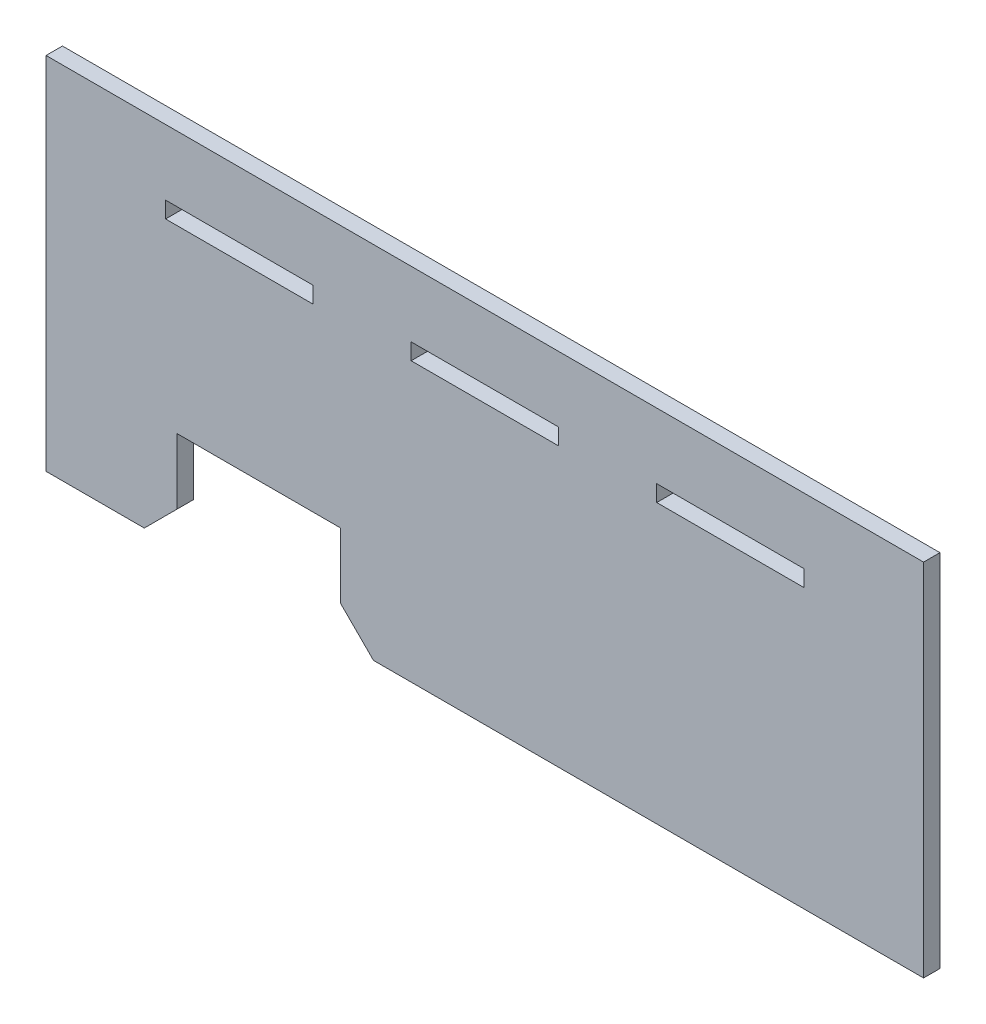
from build123d import *

# Parameters (mm, degrees)
ESQUISSE1_W        = 90
ESQUISSE1_H        = 10
BOSS_EXTRU_1_DEPTH = 10
CHANFREIN1_SIZE    = 20


with BuildPart() as part:
    # Esquisse1 → Boss.-Extru.1 (new body)
    with BuildSketch(Plane.XY):
        Polygon((0, 220), (536, 220), (536, 0), (436, 0), (200, 0), (180, 0), (180, 60), (80, 60), (80, 0), (0, 0), align=None)
        with Locations((118, 175)):
            Rectangle(ESQUISSE1_W, ESQUISSE1_H, mode=Mode.SUBTRACT)
        with Locations((268, 175)):
            Rectangle(ESQUISSE1_W, ESQUISSE1_H, mode=Mode.SUBTRACT)
        with Locations((418, 175)):
            Rectangle(ESQUISSE1_W, ESQUISSE1_H, mode=Mode.SUBTRACT)
    extrude(amount=BOSS_EXTRU_1_DEPTH)

    # Chanfrein1
    chanfrein1_edges = [part.edges().sort_by_distance(p)[0] for p in [
        (180, 0, 5),
        (80, 0, 5),
    ]]
    chamfer(chanfrein1_edges, length=CHANFREIN1_SIZE)


solid = part.part
